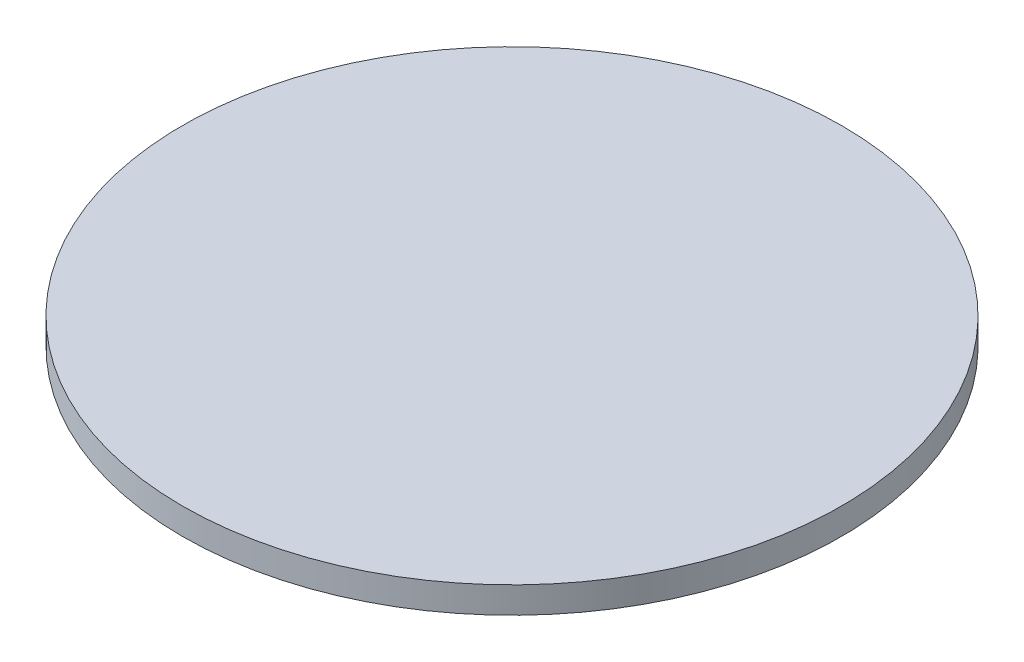
from build123d import *

# Parameters (mm, degrees)
SKETCH_1_R      = 25
EXTRUDE_1_DEPTH = 2


with BuildPart() as part:
    # 草图1 → 凸台-拉伸1 (new body)
    with BuildSketch(Plane(origin=(0, 0, 0), x_dir=(1, 0, 0), z_dir=(0, 1, 0))):
        with Locations(Location((0, 0, 0), (0, 0, 270))):
            Circle(SKETCH_1_R)
    extrude(amount=EXTRUDE_1_DEPTH)


solid = part.part
